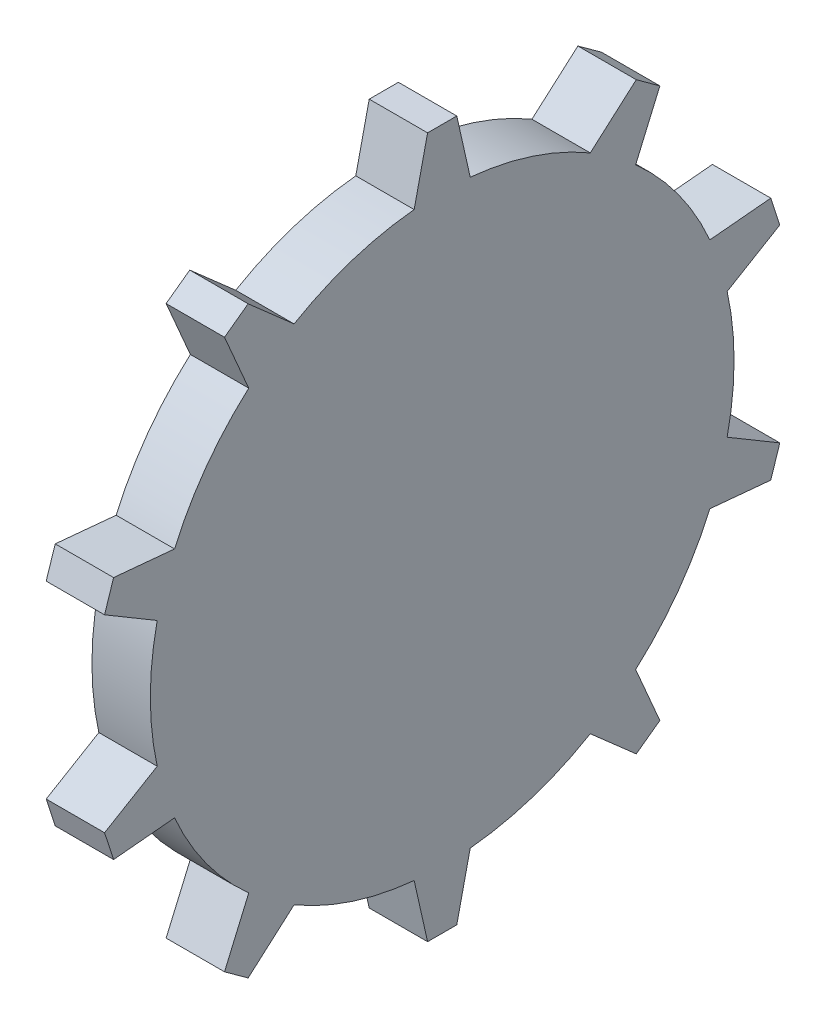
from build123d import *

# Parameters (mm, degrees)
EXTRUDE_1_DEPTH = 4


with BuildPart() as part:
    # Эскиз1 → Бобышка-Вытянуть1 (new body)
    with BuildSketch(Plane(origin=(0, 0, 0), x_dir=(0, 0, -1), z_dir=(1, 0, 0))):
        with BuildLine():
            Line((-1, 24), (1, 24))
            Line((1, 24), (1.920801391, 19.907549372))
            ThreePointArc((1.920801391, 19.907549372), (6.180339887, 19.021130326), (10.147402962, 17.234564489))
            Line((10.147402962, 17.234564489), (13.297829061, 20.004193117))
            Line((13.297829061, 20.004193117), (14.915863049, 18.828622613))
            Line((14.915863049, 18.828622613), (13.255324899, 14.976527028))
            ThreePointArc((13.255324899, 14.976527028), (16.180339887, 11.755705046), (18.339644281, 7.978561752))
            Line((18.339644281, 7.978561752), (22.516339397, 8.367464381))
            Line((22.516339397, 8.367464381), (23.134373385, 6.465351349))
            Line((23.134373385, 6.465351349), (19.526764827, 4.324980393))
            ThreePointArc((19.526764827, 4.324980393), (20, 0), (19.526764827, -4.324980393))
            Line((19.526764827, -4.324980393), (23.134373385, -6.465351349))
            Line((23.134373385, -6.465351349), (22.516339397, -8.367464381))
            Line((22.516339397, -8.367464381), (18.339644281, -7.978561752))
            ThreePointArc((18.339644281, -7.978561752), (16.180339887, -11.755705046), (13.255324899, -14.976527028))
            Line((13.255324899, -14.976527028), (14.915863049, -18.828622613))
            Line((14.915863049, -18.828622613), (13.297829061, -20.004193117))
            Line((13.297829061, -20.004193117), (10.147402962, -17.234564489))
            ThreePointArc((10.147402962, -17.234564489), (6.180339887, -19.021130326), (1.920801391, -19.907549372))
            Line((1.920801391, -19.907549372), (1, -24))
            Line((1, -24), (-1, -24))
            Line((-1, -24), (-1.920801391, -19.907549372))
            ThreePointArc((-1.920801391, -19.907549372), (-6.180339887, -19.021130326), (-10.147402962, -17.234564489))
            Line((-10.147402962, -17.234564489), (-13.297829061, -20.004193117))
            Line((-13.297829061, -20.004193117), (-14.915863049, -18.828622613))
            Line((-14.915863049, -18.828622613), (-13.255324899, -14.976527028))
            ThreePointArc((-13.255324899, -14.976527028), (-16.180339887, -11.755705046), (-18.339644281, -7.978561752))
            Line((-18.339644281, -7.978561752), (-22.516339397, -8.367464381))
            Line((-22.516339397, -8.367464381), (-23.134373385, -6.465351349))
            Line((-23.134373385, -6.465351349), (-19.526764827, -4.324980393))
            ThreePointArc((-19.526764827, -4.324980393), (-20, 0), (-19.526764827, 4.324980393))
            Line((-19.526764827, 4.324980393), (-23.134373385, 6.465351349))
            Line((-23.134373385, 6.465351349), (-22.516339397, 8.367464381))
            Line((-22.516339397, 8.367464381), (-18.339644281, 7.978561752))
            ThreePointArc((-18.339644281, 7.978561752), (-16.180339887, 11.755705046), (-13.255324899, 14.976527028))
            Line((-13.255324899, 14.976527028), (-14.915863049, 18.828622613))
            Line((-14.915863049, 18.828622613), (-13.297829061, 20.004193117))
            Line((-13.297829061, 20.004193117), (-10.147402962, 17.234564489))
            ThreePointArc((-10.147402962, 17.234564489), (-6.180339887, 19.021130326), (-1.920801391, 19.907549372))
            Line((-1.920801391, 19.907549372), (-1, 24))
        make_face()
    extrude(amount=EXTRUDE_1_DEPTH)


solid = part.part
